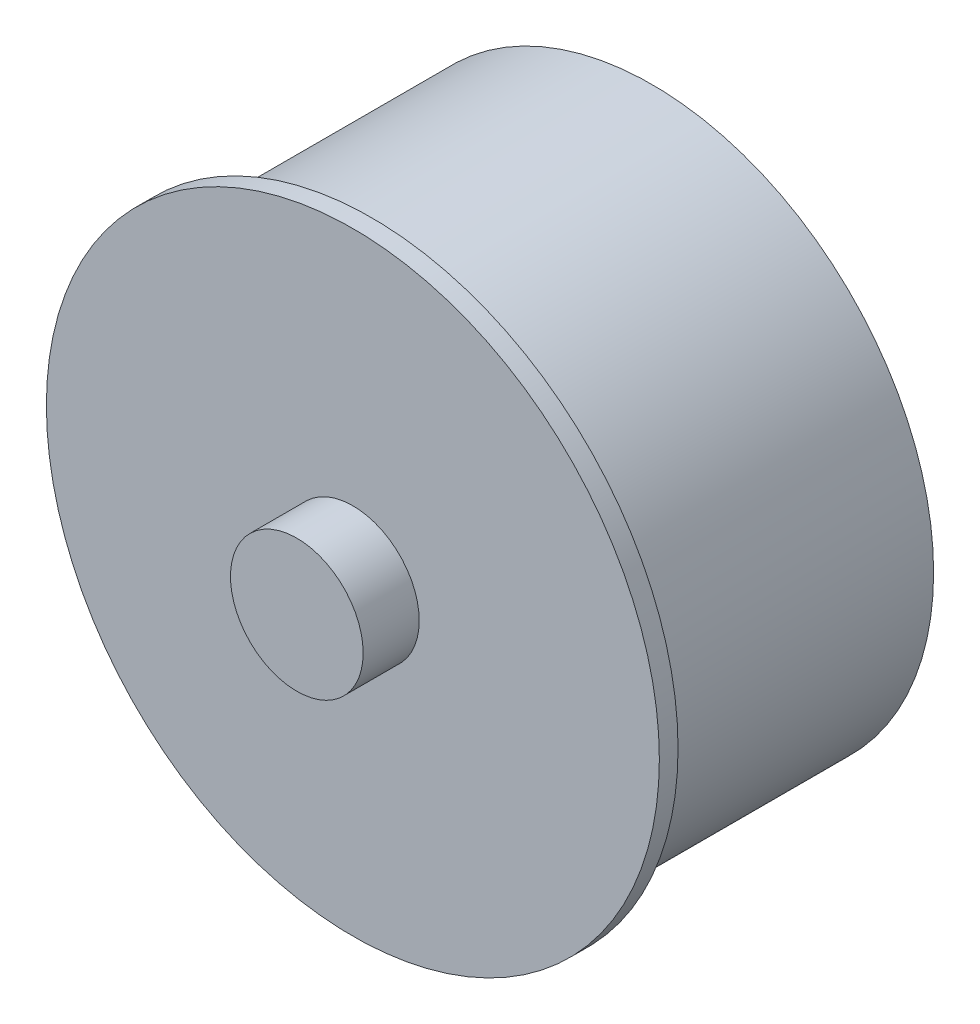
from build123d import *

# Parameters (mm, degrees)
SKETCH_1_R          = 16.4
EXTRUDE_1_DEPTH     = 17
SKETCH_2_R          = 3.55
EXTRUDE_2_DEPTH     = 3
SKETCH_3_R          = 10.075
EXTRUDE_3_DEPTH     = 2
SKETCH_7_R          = 1.05
CUT_EXTRUDE_3_DEPTH = 10
SKETCH3_R           = 16.4
SKETCH3_R_2         = 15.075
CUT_EXTRUDE1_DEPTH  = 16
SKETCH4_R           = 15.075
SKETCH4_R_2         = 10.075
CUT_EXTRUDE2_DEPTH  = 1
SKETCH5_R           = 10.075
CUT_EXTRUDE3_DEPTH  = 1


with BuildPart() as part:
    # 草图1 → 凸台-拉伸1 (new body)
    with BuildSketch(Plane.XY):
        Circle(SKETCH_1_R)
    extrude(amount=EXTRUDE_1_DEPTH)

    # 草图2 → 凸台-拉伸2 (add)
    with BuildSketch(Plane.XY.offset(17)):
        Circle(SKETCH_2_R)
    extrude(amount=EXTRUDE_2_DEPTH)


with BuildPart() as body_2:
    # 草图3 → 凸台-拉伸3 (new body)
    with BuildSketch(Plane(origin=(0, 0, 0), x_dir=(-1, 0, 0), z_dir=(0, 0, -1))):
        Circle(SKETCH_3_R)
    extrude(amount=EXTRUDE_3_DEPTH)


with BuildPart() as cut_extrude_3_tool:
    # 草图7 → 切除-拉伸3 (new body)
    with BuildSketch(Plane(origin=(0, 0, -2), x_dir=(-1, 0, 0), z_dir=(0, 0, -1))):
        with Locations((0, 8)):
            Circle(SKETCH_7_R)
        with Locations((8, 0)):
            Circle(SKETCH_7_R)
        with Locations((0, -8)):
            Circle(SKETCH_7_R)
        with Locations((-8, 0)):
            Circle(SKETCH_7_R)
    extrude(amount=-CUT_EXTRUDE_3_DEPTH)


with BuildPart() as part_1:
    add(part.part)

    # 切除-拉伸3: cut by cut_extrude_3_tool
    add(cut_extrude_3_tool.part, mode=Mode.SUBTRACT)

    # Sketch3 → Cut-Extrude1 (cut)
    with BuildSketch(Plane(origin=(0, 0, 0), x_dir=(-1, 0, 0), z_dir=(0, 0, -1))):
        Circle(SKETCH3_R)
        Circle(SKETCH3_R_2, mode=Mode.SUBTRACT)
    extrude(amount=-CUT_EXTRUDE1_DEPTH, mode=Mode.SUBTRACT)

    # Sketch4 → Cut-Extrude2 (cut)
    with BuildSketch(Plane(origin=(0, 0, 0), x_dir=(-1, 0, 0), z_dir=(0, 0, -1))):
        Circle(SKETCH4_R)
        Circle(SKETCH4_R_2, mode=Mode.SUBTRACT)
    extrude(amount=-CUT_EXTRUDE2_DEPTH, mode=Mode.SUBTRACT)


with BuildPart() as body_2_1:
    add(body_2.part)

    # 切除-拉伸3: cut by cut_extrude_3_tool
    add(cut_extrude_3_tool.part, mode=Mode.SUBTRACT)

    # Sketch5 → Cut-Extrude3 (cut)
    with BuildSketch(Plane(origin=(0, 0, -2), x_dir=(-1, 0, 0), z_dir=(0, 0, -1))):
        Circle(SKETCH5_R)
    extrude(amount=-CUT_EXTRUDE3_DEPTH, mode=Mode.SUBTRACT)


solid = Compound([part_1.part, body_2_1.part])
